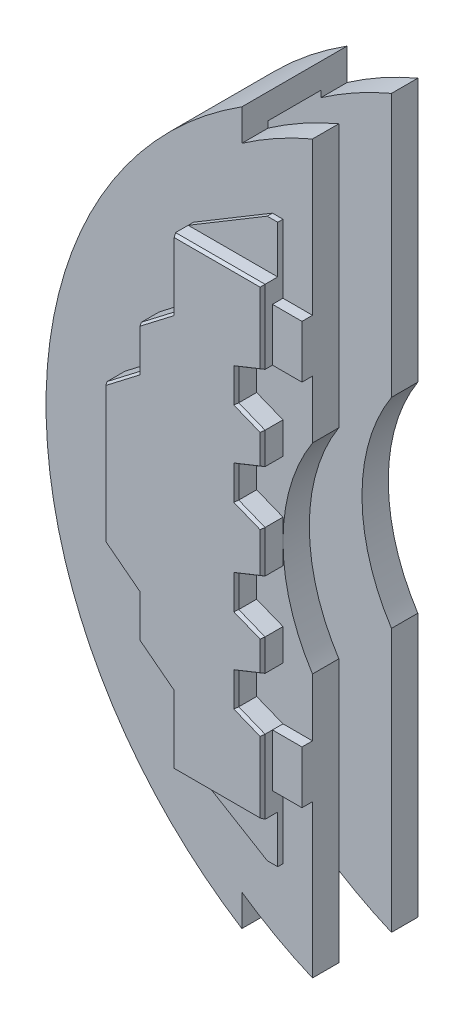
from build123d import *
from OCP.BRepFilletAPI import BRepFilletAPI_MakeChamfer

# Parameters (mm, degrees)
BOSS_EXTRUDE1_DEPTH = 5
BOSS_EXTRUDE2_DEPTH = 2
SKETCH5_W           = 2.803061543
SKETCH5_H           = 5
BOSS_EXTRUDE3_DEPTH = 1
BOSS_EXTRUDE4_DEPTH = 0.5
SKETCH7_W           = 5
SKETCH7_H           = 38
CHAMFER1_SIZE       = 0.3
CHAMFER1_SIZE2      = 0.173205081


with BuildPart() as part:
    # Sketch2 → Boss-Extrude1 (new, symmetric)
    with BuildSketch(Plane.XY):
        with BuildLine():
            Line((-14.696938457, 34.5), (-14.696938457, 9.5))
            ThreePointArc((-14.696938457, 9.5), (-16.784612343, 4.952452777), (-17.5, 0))
            Line((-17.5, 0), (-40, 0))
            ThreePointArc((-40, 0), (-35.043919369, 19.285323831), (-21.403814237, 33.791666667))
            Line((-21.403814237, 33.791666667), (-21.403814237, 30.791666667))
            ThreePointArc((-21.403814237, 30.791666667), (-18.145358092, 32.817616911), (-14.696938457, 34.5))
        make_face()
    extrude(amount=BOSS_EXTRUDE1_DEPTH, both=True)

    # Sketch4 → Boss-Extrude2 (add)
    with BuildSketch(Plane.XY.offset(5)):
        Polygon((-17.5, 15), (-20, 14), (-20, 11), (-17.5, 10), (-17.5, 7), (-20, 6), (-20, 3), (-17.5, 2), (-17.5, 0), (-32.5, 0), (-32.5, 6.5), (-29.25, 9), (-29.25, 13), (-26, 15.5), (-26, 22), (-17.5, 22), align=None)
    extrude(amount=BOSS_EXTRUDE2_DEPTH)

    # Sketch5 → Boss-Extrude3 (add)
    with BuildSketch(Plane.XY.offset(5)):
        with Locations((-16.098469229, 17.5)):
            Rectangle(SKETCH5_W, SKETCH5_H)
    extrude(amount=BOSS_EXTRUDE3_DEPTH)

    # Sketch6 → Boss-Extrude4 (add)
    with BuildSketch(Plane.XY.offset(5)):
        Polygon((-26, 22), (-18.5, 26.5), (-17.5, 26.5), (-17.5, 22), align=None)
    extrude(amount=BOSS_EXTRUDE4_DEPTH)

    # Sketch7 → Cut-Revolve1 (revolve, cut)
    with BuildSketch(Plane(origin=(0, 0, 0), x_dir=(0, 0, -1), z_dir=(1, 0, 0))):
        with Locations((0, 19)):
            Rectangle(SKETCH7_W, SKETCH7_H)
    revolve(axis=Axis((0, 0, 2.5), (0, 0, -1)), mode=Mode.SUBTRACT)

    # Mirror1: part across plane


with BuildPart() as part_1:
    add(part.part)
    add(part.part.mirror(Plane.ZX))

    # Chamfer1: one chamfer whose edges measure the first distance from different faces: ONE call of the kernel's chamfer builder (chamfer() names one face for all edges)
    chamfer1_edges_1 = [part_1.edges().sort_by_distance(p)[0] for p in [
        (-17.5, -18.5, 7),
    ]]
    chamfer1_side_1 = [part_1.faces().sort_by_distance(p)[0] for p in [
        (-17.5, -20.094444444, 6.072222222),
    ]]
    chamfer1_edges_2 = [part_1.edges().sort_by_distance(p)[0] for p in [
        (-18.75, -2.5, 7),
    ]]
    chamfer1_side_2 = [part_1.faces().sort_by_distance(p)[0] for p in [
        (-18.75, -2.5, 6),
    ]]
    chamfer1_edges_3 = [part_1.edges().sort_by_distance(p)[0] for p in [
        (-20, -4.5, 7),
    ]]
    chamfer1_side_3 = [part_1.faces().sort_by_distance(p)[0] for p in [
        (-20, -4.5, 6),
    ]]
    chamfer1_edges_4 = [part_1.edges().sort_by_distance(p)[0] for p in [
        (-18.75, -6.5, 7),
    ]]
    chamfer1_side_4 = [part_1.faces().sort_by_distance(p)[0] for p in [
        (-18.75, -6.5, 6),
    ]]
    chamfer1_edges_5 = [part_1.edges().sort_by_distance(p)[0] for p in [
        (-17.5, -8.5, 7),
    ]]
    chamfer1_side_5 = [part_1.faces().sort_by_distance(p)[0] for p in [
        (-17.5, -8.5, 6),
    ]]
    chamfer1_edges_6 = [part_1.edges().sort_by_distance(p)[0] for p in [
        (-18.75, -10.5, 7),
    ]]
    chamfer1_side_6 = [part_1.faces().sort_by_distance(p)[0] for p in [
        (-18.75, -10.5, 6),
    ]]
    chamfer1_edges_7 = [part_1.edges().sort_by_distance(p)[0] for p in [
        (-20, -12.5, 7),
    ]]
    chamfer1_side_7 = [part_1.faces().sort_by_distance(p)[0] for p in [
        (-20, -12.5, 6),
    ]]
    chamfer1_edges_8 = [part_1.edges().sort_by_distance(p)[0] for p in [
        (-18.75, -14.5, 7),
    ]]
    chamfer1_side_8 = [part_1.faces().sort_by_distance(p)[0] for p in [
        (-18.75, -14.5, 6),
    ]]
    chamfer1_edges_9 = [part_1.edges().sort_by_distance(p)[0] for p in [
        (-21.75, -22, 7),
    ]]
    chamfer1_side_9 = [part_1.faces().sort_by_distance(p)[0] for p in [
        (-21.75, -22, 6.25),
    ]]
    chamfer1_edges_10 = [part_1.edges().sort_by_distance(p)[0] for p in [
        (-26, -18.75, 7),
    ]]
    chamfer1_side_10 = [part_1.faces().sort_by_distance(p)[0] for p in [
        (-26, -18.75, 6),
    ]]
    chamfer1_edges_11 = [part_1.edges().sort_by_distance(p)[0] for p in [
        (-27.625, -14.25, 7),
    ]]
    chamfer1_side_11 = [part_1.faces().sort_by_distance(p)[0] for p in [
        (-27.625, -14.25, 6),
    ]]
    chamfer1_edges_12 = [part_1.edges().sort_by_distance(p)[0] for p in [
        (-29.25, -11, 7),
    ]]
    chamfer1_side_12 = [part_1.faces().sort_by_distance(p)[0] for p in [
        (-29.25, -11, 6),
    ]]
    chamfer1_edges_13 = [part_1.edges().sort_by_distance(p)[0] for p in [
        (-30.875, -7.75, 7),
    ]]
    chamfer1_side_13 = [part_1.faces().sort_by_distance(p)[0] for p in [
        (-30.875, -7.75, 6),
    ]]
    chamfer1_edges_14 = [part_1.edges().sort_by_distance(p)[0] for p in [
        (-17.5, 0, 7),
    ]]
    chamfer1_side_14 = [part_1.faces().sort_by_distance(p)[0] for p in [
        (-17.5, 0, 6),
    ]]
    chamfer1_edges_15 = [part_1.edges().sort_by_distance(p)[0] for p in [
        (-18.75, 2.5, 7),
    ]]
    chamfer1_side_15 = [part_1.faces().sort_by_distance(p)[0] for p in [
        (-18.75, 2.5, 6),
    ]]
    chamfer1_edges_16 = [part_1.edges().sort_by_distance(p)[0] for p in [
        (-20, 4.5, 7),
    ]]
    chamfer1_side_16 = [part_1.faces().sort_by_distance(p)[0] for p in [
        (-20, 4.5, 6),
    ]]
    chamfer1_edges_17 = [part_1.edges().sort_by_distance(p)[0] for p in [
        (-18.75, 6.5, 7),
    ]]
    chamfer1_side_17 = [part_1.faces().sort_by_distance(p)[0] for p in [
        (-18.75, 6.5, 6),
    ]]
    chamfer1_edges_18 = [part_1.edges().sort_by_distance(p)[0] for p in [
        (-17.5, 8.5, 7),
    ]]
    chamfer1_side_18 = [part_1.faces().sort_by_distance(p)[0] for p in [
        (-17.5, 8.5, 6),
    ]]
    chamfer1_edges_19 = [part_1.edges().sort_by_distance(p)[0] for p in [
        (-18.75, 10.5, 7),
    ]]
    chamfer1_side_19 = [part_1.faces().sort_by_distance(p)[0] for p in [
        (-18.75, 10.5, 6),
    ]]
    chamfer1_edges_20 = [part_1.edges().sort_by_distance(p)[0] for p in [
        (-20, 12.5, 7),
    ]]
    chamfer1_side_20 = [part_1.faces().sort_by_distance(p)[0] for p in [
        (-20, 12.5, 6),
    ]]
    chamfer1_edges_21 = [part_1.edges().sort_by_distance(p)[0] for p in [
        (-18.75, 14.5, 7),
    ]]
    chamfer1_side_21 = [part_1.faces().sort_by_distance(p)[0] for p in [
        (-18.75, 14.5, 6),
    ]]
    chamfer1_edges_22 = [part_1.edges().sort_by_distance(p)[0] for p in [
        (-17.5, 18.5, 7),
    ]]
    chamfer1_side_22 = [part_1.faces().sort_by_distance(p)[0] for p in [
        (-17.5, 20.094444444, 6.072222222),
    ]]
    chamfer1_edges_23 = [part_1.edges().sort_by_distance(p)[0] for p in [
        (-21.75, 22, 7),
    ]]
    chamfer1_side_23 = [part_1.faces().sort_by_distance(p)[0] for p in [
        (-21.75, 22, 6.25),
    ]]
    chamfer1_edges_24 = [part_1.edges().sort_by_distance(p)[0] for p in [
        (-26, 18.75, 7),
    ]]
    chamfer1_side_24 = [part_1.faces().sort_by_distance(p)[0] for p in [
        (-26, 18.75, 6),
    ]]
    chamfer1_edges_25 = [part_1.edges().sort_by_distance(p)[0] for p in [
        (-27.625, 14.25, 7),
    ]]
    chamfer1_side_25 = [part_1.faces().sort_by_distance(p)[0] for p in [
        (-27.625, 14.25, 6),
    ]]
    chamfer1_edges_26 = [part_1.edges().sort_by_distance(p)[0] for p in [
        (-29.25, 11, 7),
    ]]
    chamfer1_side_26 = [part_1.faces().sort_by_distance(p)[0] for p in [
        (-29.25, 11, 6),
    ]]
    chamfer1_edges_27 = [part_1.edges().sort_by_distance(p)[0] for p in [
        (-30.875, 7.75, 7),
    ]]
    chamfer1_side_27 = [part_1.faces().sort_by_distance(p)[0] for p in [
        (-30.875, 7.75, 6),
    ]]
    chamfer1_edges_28 = [part_1.edges().sort_by_distance(p)[0] for p in [
        (-32.5, 0, 7),
    ]]
    chamfer1_side_28 = [part_1.faces().sort_by_distance(p)[0] for p in [
        (-32.5, 0, 6),
    ]]
    chamfer1 = BRepFilletAPI_MakeChamfer(part_1.part.solid().wrapped)
    for e in chamfer1_edges_1:
        chamfer1.Add(CHAMFER1_SIZE, CHAMFER1_SIZE2, e.wrapped, chamfer1_side_1[0].wrapped)  # the first distance lies on this face
    for e in chamfer1_edges_2:
        chamfer1.Add(CHAMFER1_SIZE, CHAMFER1_SIZE2, e.wrapped, chamfer1_side_2[0].wrapped)  # the first distance lies on this face
    for e in chamfer1_edges_3:
        chamfer1.Add(CHAMFER1_SIZE, CHAMFER1_SIZE2, e.wrapped, chamfer1_side_3[0].wrapped)  # the first distance lies on this face
    for e in chamfer1_edges_4:
        chamfer1.Add(CHAMFER1_SIZE, CHAMFER1_SIZE2, e.wrapped, chamfer1_side_4[0].wrapped)  # the first distance lies on this face
    for e in chamfer1_edges_5:
        chamfer1.Add(CHAMFER1_SIZE, CHAMFER1_SIZE2, e.wrapped, chamfer1_side_5[0].wrapped)  # the first distance lies on this face
    for e in chamfer1_edges_6:
        chamfer1.Add(CHAMFER1_SIZE, CHAMFER1_SIZE2, e.wrapped, chamfer1_side_6[0].wrapped)  # the first distance lies on this face
    for e in chamfer1_edges_7:
        chamfer1.Add(CHAMFER1_SIZE, CHAMFER1_SIZE2, e.wrapped, chamfer1_side_7[0].wrapped)  # the first distance lies on this face
    for e in chamfer1_edges_8:
        chamfer1.Add(CHAMFER1_SIZE, CHAMFER1_SIZE2, e.wrapped, chamfer1_side_8[0].wrapped)  # the first distance lies on this face
    for e in chamfer1_edges_9:
        chamfer1.Add(CHAMFER1_SIZE, CHAMFER1_SIZE2, e.wrapped, chamfer1_side_9[0].wrapped)  # the first distance lies on this face
    for e in chamfer1_edges_10:
        chamfer1.Add(CHAMFER1_SIZE, CHAMFER1_SIZE2, e.wrapped, chamfer1_side_10[0].wrapped)  # the first distance lies on this face
    for e in chamfer1_edges_11:
        chamfer1.Add(CHAMFER1_SIZE, CHAMFER1_SIZE2, e.wrapped, chamfer1_side_11[0].wrapped)  # the first distance lies on this face
    for e in chamfer1_edges_12:
        chamfer1.Add(CHAMFER1_SIZE, CHAMFER1_SIZE2, e.wrapped, chamfer1_side_12[0].wrapped)  # the first distance lies on this face
    for e in chamfer1_edges_13:
        chamfer1.Add(CHAMFER1_SIZE, CHAMFER1_SIZE2, e.wrapped, chamfer1_side_13[0].wrapped)  # the first distance lies on this face
    for e in chamfer1_edges_14:
        chamfer1.Add(CHAMFER1_SIZE, CHAMFER1_SIZE2, e.wrapped, chamfer1_side_14[0].wrapped)  # the first distance lies on this face
    for e in chamfer1_edges_15:
        chamfer1.Add(CHAMFER1_SIZE, CHAMFER1_SIZE2, e.wrapped, chamfer1_side_15[0].wrapped)  # the first distance lies on this face
    for e in chamfer1_edges_16:
        chamfer1.Add(CHAMFER1_SIZE, CHAMFER1_SIZE2, e.wrapped, chamfer1_side_16[0].wrapped)  # the first distance lies on this face
    for e in chamfer1_edges_17:
        chamfer1.Add(CHAMFER1_SIZE, CHAMFER1_SIZE2, e.wrapped, chamfer1_side_17[0].wrapped)  # the first distance lies on this face
    for e in chamfer1_edges_18:
        chamfer1.Add(CHAMFER1_SIZE, CHAMFER1_SIZE2, e.wrapped, chamfer1_side_18[0].wrapped)  # the first distance lies on this face
    for e in chamfer1_edges_19:
        chamfer1.Add(CHAMFER1_SIZE, CHAMFER1_SIZE2, e.wrapped, chamfer1_side_19[0].wrapped)  # the first distance lies on this face
    for e in chamfer1_edges_20:
        chamfer1.Add(CHAMFER1_SIZE, CHAMFER1_SIZE2, e.wrapped, chamfer1_side_20[0].wrapped)  # the first distance lies on this face
    for e in chamfer1_edges_21:
        chamfer1.Add(CHAMFER1_SIZE, CHAMFER1_SIZE2, e.wrapped, chamfer1_side_21[0].wrapped)  # the first distance lies on this face
    for e in chamfer1_edges_22:
        chamfer1.Add(CHAMFER1_SIZE, CHAMFER1_SIZE2, e.wrapped, chamfer1_side_22[0].wrapped)  # the first distance lies on this face
    for e in chamfer1_edges_23:
        chamfer1.Add(CHAMFER1_SIZE, CHAMFER1_SIZE2, e.wrapped, chamfer1_side_23[0].wrapped)  # the first distance lies on this face
    for e in chamfer1_edges_24:
        chamfer1.Add(CHAMFER1_SIZE, CHAMFER1_SIZE2, e.wrapped, chamfer1_side_24[0].wrapped)  # the first distance lies on this face
    for e in chamfer1_edges_25:
        chamfer1.Add(CHAMFER1_SIZE, CHAMFER1_SIZE2, e.wrapped, chamfer1_side_25[0].wrapped)  # the first distance lies on this face
    for e in chamfer1_edges_26:
        chamfer1.Add(CHAMFER1_SIZE, CHAMFER1_SIZE2, e.wrapped, chamfer1_side_26[0].wrapped)  # the first distance lies on this face
    for e in chamfer1_edges_27:
        chamfer1.Add(CHAMFER1_SIZE, CHAMFER1_SIZE2, e.wrapped, chamfer1_side_27[0].wrapped)  # the first distance lies on this face
    for e in chamfer1_edges_28:
        chamfer1.Add(CHAMFER1_SIZE, CHAMFER1_SIZE2, e.wrapped, chamfer1_side_28[0].wrapped)  # the first distance lies on this face
    add(Compound.cast(chamfer1.Shape()), mode=Mode.REPLACE)


solid = part_1.part
